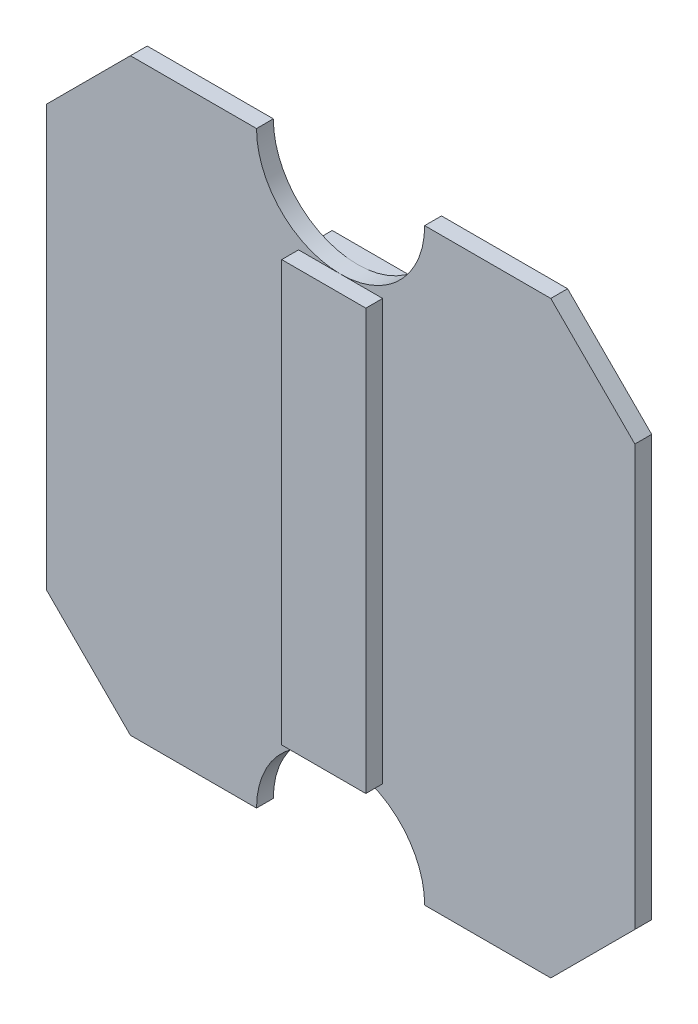
from build123d import *

# Parameters (mm, degrees)
BOSS_EXTRUDE1_DEPTH      = 10
BOSS_EXTRUDE2_DEPTH      = 10
BOSS_EXTRUDE2_DEPTH_BACK = 20


with BuildPart() as part:
    # Sketch1 → Boss-Extrude1 (new body)
    with BuildSketch(Plane.XY):
        with BuildLine():
            Line((-125, 175), (-50, 175))
            ThreePointArc((-50, 175), (0, 125), (50, 175))
            Line((50, 175), (125, 175))
            Line((125, 175), (175, 125))
            Line((175, 125), (175, -125))
            Line((175, -125), (125, -175))
            Line((125, -175), (50, -175))
            ThreePointArc((50, -175), (0, -125), (-50, -175))
            Line((-50, -175), (-125, -175))
            Line((-125, -175), (-175, -125))
            Line((-175, -125), (-175, 125))
            Line((-175, 125), (-125, 175))
        make_face()
    extrude(amount=BOSS_EXTRUDE1_DEPTH)

    # Sketch2 → Boss-Extrude2 (add, two sides: drawn at the far end of the back side and taken through both)
    with BuildSketch(Plane.XY.offset(10).offset(-BOSS_EXTRUDE2_DEPTH_BACK)):
        Polygon((25, 125), (-2.148886373, 125), (-25, 125), (-25, 0), (-25, -125), (25, -125), align=None)
    extrude(amount=BOSS_EXTRUDE2_DEPTH + BOSS_EXTRUDE2_DEPTH_BACK)


solid = part.part
